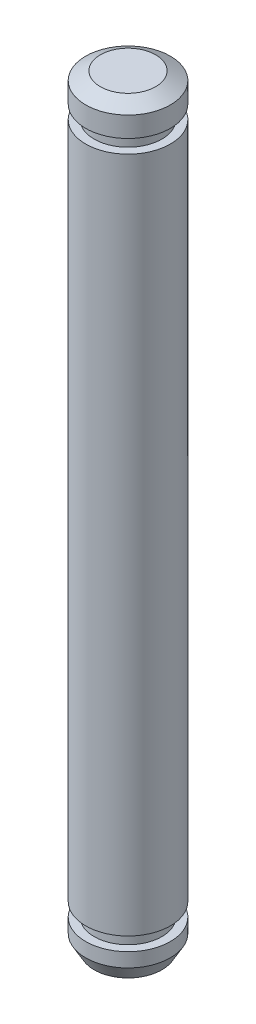
from build123d import *
from OCP.BRepFilletAPI import BRepFilletAPI_MakeChamfer

# Parameters (mm, degrees)
SKETCH_1_R          = 2.5
EXTRUDE_2_DEPTH     = 22.5
SKETCH_2_R          = 2.5
SKETCH_2_R_2        = 2
CUT_EXTRUDE_1_DEPTH = 0.8
CHAMFER_3_SIZE      = 0.5
CHAMFER_3_SIZE2     = 0.866025404


with BuildPart() as part:
    # 草图1 → 凸台-拉伸2 (new body)
    with BuildSketch(Plane(origin=(0, 0, 0), x_dir=(1, 0, 0), z_dir=(0, 1, 0))):
        with Locations(Location((0, 0, 0), (0, 0, 90))):
            Circle(SKETCH_1_R)
    extrude_2 = extrude(amount=EXTRUDE_2_DEPTH)

    # 草图2 → 切除-拉伸1 (cut)
    with BuildSketch(Plane(origin=(0, 20, 0), x_dir=(1, 0, 0), z_dir=(0, 1, 0))):
        with Locations(Location((0, 0, 0), (0, 0, 90))):
            Circle(SKETCH_2_R)
        with Locations(Location((0, 0, 0), (0, 0, 270))):
            Circle(SKETCH_2_R_2, mode=Mode.SUBTRACT)
    cut_extrude_1 = extrude(amount=CUT_EXTRUDE_1_DEPTH, mode=Mode.SUBTRACT)

    # 镜向3: 凸台-拉伸2 across plane
    add(extrude_2.mirror(Plane.ZX))

    # 镜向5: 切除-拉伸1 across plane
    add(cut_extrude_1.mirror(Plane.ZX), mode=Mode.SUBTRACT)

    # 倒角3: one chamfer whose edges measure the first distance from different faces: ONE call of the kernel's chamfer builder (chamfer() names one face for all edges)
    chamfer_3_edges_1 = [part.edges().sort_by_distance(p)[0] for p in [
        (0, -22.5, 2.5),
    ]]
    chamfer_3_side_1 = [part.faces().sort_by_distance(p)[0] for p in [
        (0, -22.5, 0),
    ]]
    chamfer_3_edges_2 = [part.edges().sort_by_distance(p)[0] for p in [
        (0, 22.5, 2.5),
    ]]
    chamfer_3_side_2 = [part.faces().sort_by_distance(p)[0] for p in [
        (0, 21.65, 2.5),
    ]]
    chamfer_3 = BRepFilletAPI_MakeChamfer(part.part.solid().wrapped)
    for e in chamfer_3_edges_1:
        chamfer_3.Add(CHAMFER_3_SIZE, CHAMFER_3_SIZE2, e.wrapped, chamfer_3_side_1[0].wrapped)  # the first distance lies on this face
    for e in chamfer_3_edges_2:
        chamfer_3.Add(CHAMFER_3_SIZE, CHAMFER_3_SIZE2, e.wrapped, chamfer_3_side_2[0].wrapped)  # the first distance lies on this face
    add(Compound.cast(chamfer_3.Shape()), mode=Mode.REPLACE)


solid = part.part
